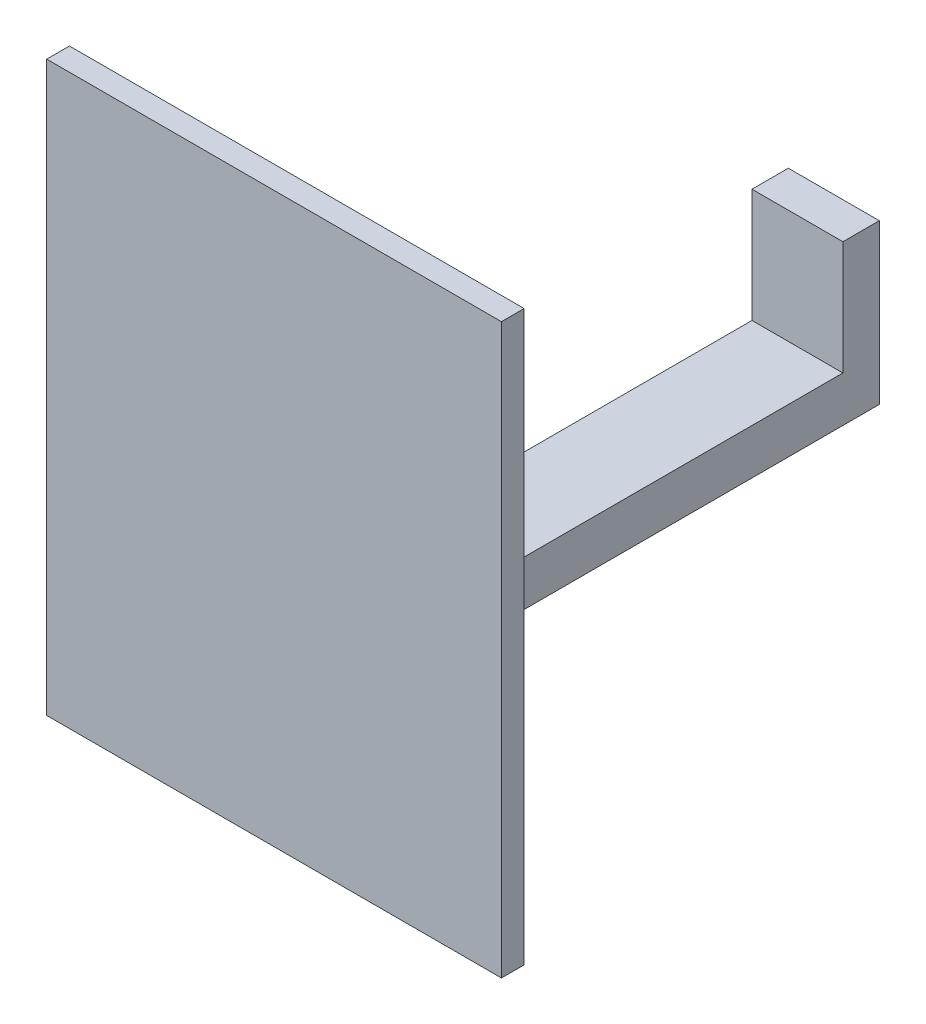
from build123d import *

# Parameters (mm, degrees)
SKETCH_1_W      = 40
SKETCH_1_H      = 16
EXTRUDE_1_DEPTH = 70
SKETCH_2_W      = 40
SKETCH_2_H      = 20
EXTRUDE_2_DEPTH = 220
SKETCH_4_W      = 200
SKETCH_4_H      = 250
EXTRUDE_4_DEPTH = 10


with BuildPart() as part:
    # 草图1 → 凸台-拉伸1 (new body)
    with BuildSketch(Plane(origin=(0, 0, 0), x_dir=(1, 0, 0), z_dir=(0, 1, 0))):
        Rectangle(SKETCH_1_W, SKETCH_1_H)
    extrude(amount=EXTRUDE_1_DEPTH)

    # 草图2 → 凸台-拉伸2 (add)
    with BuildSketch(Plane.XY.offset(8)):
        with Locations((0, 10)):
            Rectangle(SKETCH_2_W, SKETCH_2_H)
    extrude(amount=EXTRUDE_2_DEPTH)

    # 草图4 → 凸台-拉伸4 (add)
    with BuildSketch(Plane.XY.offset(228)):
        with Locations((-0.193037092, 69.445287213)):
            Rectangle(SKETCH_4_W, SKETCH_4_H)
    extrude(amount=EXTRUDE_4_DEPTH)


solid = part.part
